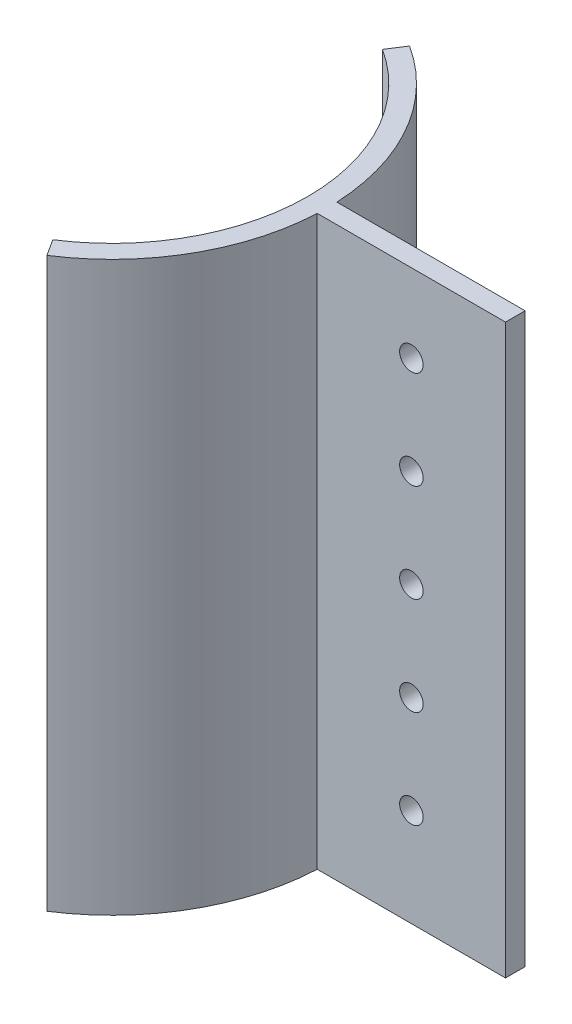
from build123d import *

# Parameters (mm, degrees)
EXTRUDE_THIN1_DEPTH = 36.25
SKETCH2_W           = 25
SKETCH2_H           = 72.5
BOSS_EXTRUDE1_DEPTH = 1.25
LPATTERN1_COUNT     = 5
LPATTERN1_PITCH     = 12.5


with BuildPart() as part:
    # Sketch1 → Extrude-Thin1 (new, symmetric)
    with BuildSketch(Plane(origin=(0, 0, 0), x_dir=(1, 0, 0), z_dir=(0, 1, 0))):
        with BuildLine():
            ThreePointArc((13.507557647, 21.03677462), (25, 0), (13.507557647, -21.03677462))
            Line((13.507557647, -21.03677462), (14.858313411, -23.140452082))
            ThreePointArc((14.858313411, -23.140452082), (27.5, 0), (14.858313411, 23.140452082))
            Line((14.858313411, 23.140452082), (13.507557647, 21.03677462))
        make_face()
    extrude(amount=EXTRUDE_THIN1_DEPTH, both=True)

    # Sketch2 → Boss-Extrude1 (add, symmetric)
    with BuildSketch(Plane.XY):
        with Locations((39, 0)):
            Rectangle(SKETCH2_W, SKETCH2_H)
    extrude(amount=BOSS_EXTRUDE1_DEPTH, both=True)

    # Sketch4 → Ø3.0mm Dowel Hole1 (revolve, cut)
    with BuildSketch(Plane(origin=(39.48578811, 26.25, 1.25), x_dir=(0, -1, 0), z_dir=(1, 0, 0))):
        Polygon((0, 0), (0, 2.5), (1.525, 2.5), (1.5, 2.475), (1.5, 0), align=None)
    f_3_0mm_dowel_hole1 = revolve(axis=Axis((39.48578811, 26.25, 7.6), (0, 0, -1)), mode=Mode.SUBTRACT)

    # LPattern1: Ø3.0mm Dowel Hole1 ×5
    with Locations(*[(0, -i * LPATTERN1_PITCH, 0) for i in range(1, LPATTERN1_COUNT)]):
        add(f_3_0mm_dowel_hole1, mode=Mode.SUBTRACT)


solid = part.part
